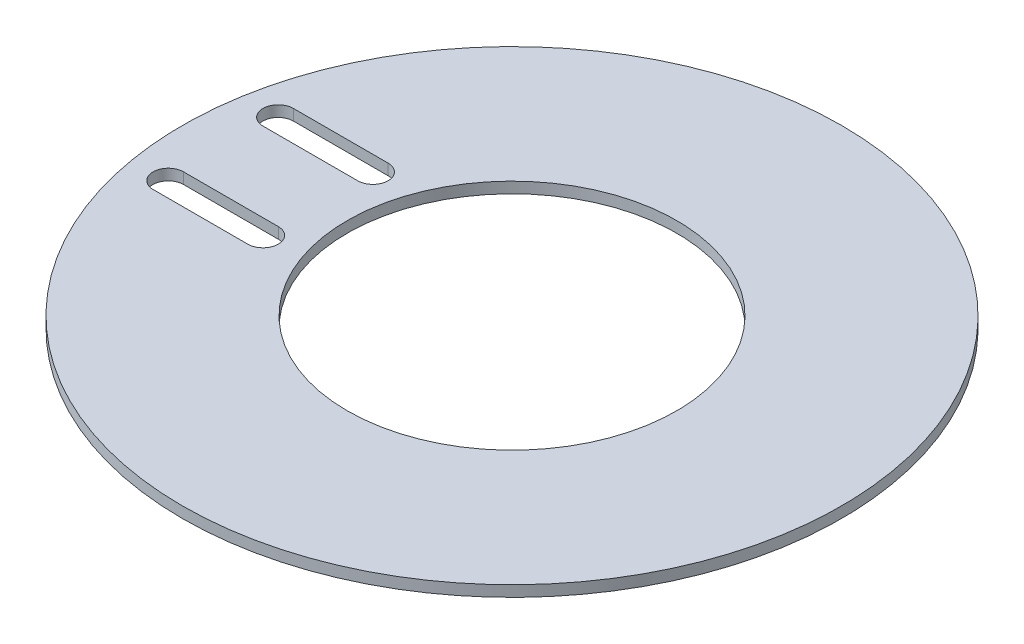
from build123d import *

# Parameters (mm, degrees)
SKETCH1_R           = 76.2
SKETCH1_R_2         = 38.1
BOSS_EXTRUDE1_DEPTH = 2.54
SCALE1_SCALE        = 3
SCALE2_SCALE        = 3
SCALE3_SCALE        = 3
SCALE4_SCALE        = 0.88


with BuildPart() as part:
    # Sketch1 → Boss-Extrude1 (new body)
    with BuildSketch(Plane(origin=(0, 0, 0), x_dir=(1, 0, 0), z_dir=(0, 1, 0))):
        with Locations(Location((0, 0, 0), (0, 0, 270))):
            Circle(SKETCH1_R)
        with Locations(Location((0, 0, 0), (0, 0, 270))):
            Circle(SKETCH1_R_2, mode=Mode.SUBTRACT)
        with BuildLine():
            Line((-66.766496625, 16.226296333), (-44.86093692, 16.226296333))
            ThreePointArc((-44.86093692, 16.226296333), (-41.334640587, 12.7), (-44.86093692, 9.173703667))
            Line((-44.86093692, 9.173703667), (-66.766496625, 9.173703667))
            ThreePointArc((-66.766496625, 9.173703667), (-70.292792958, 12.7), (-66.766496625, 16.226296333))
        make_face(mode=Mode.SUBTRACT)
        with BuildLine():
            Line((-66.766496625, -16.226296333), (-44.86093692, -16.226296333))
            ThreePointArc((-44.86093692, -16.226296333), (-41.334640587, -12.7), (-44.86093692, -9.173703667))
            Line((-44.86093692, -9.173703667), (-66.766496625, -9.173703667))
            ThreePointArc((-66.766496625, -9.173703667), (-70.292792958, -12.7), (-66.766496625, -16.226296333))
        make_face(mode=Mode.SUBTRACT)
    extrude(amount=BOSS_EXTRUDE1_DEPTH)


with BuildPart() as part_1:
    # Scale1: scaled about (1.625257345, 1.27, 0)
    add(part.part.scale(SCALE1_SCALE).moved(Location((-3.25051469, -2.54, 0))))


with BuildPart() as part_2:
    # Scale2: scaled about (1.625257344, 1.27, 0)
    add(part_1.part.scale(SCALE2_SCALE).moved(Location((-3.250514688, -2.54, 0))))


with BuildPart() as part_3:
    # Scale3: scaled about (1.625257343, 1.27, 0)
    add(part_2.part.scale(SCALE3_SCALE).moved(Location((-3.250514686, -2.54, 0))))


with BuildPart() as part_4:
    # Scale4: scaled about (1.625257342, 1.27, 0)
    add(part_3.part.scale(SCALE4_SCALE).moved(Location((0.195030881, 0.1524, 0))))


solid = part_4.part
